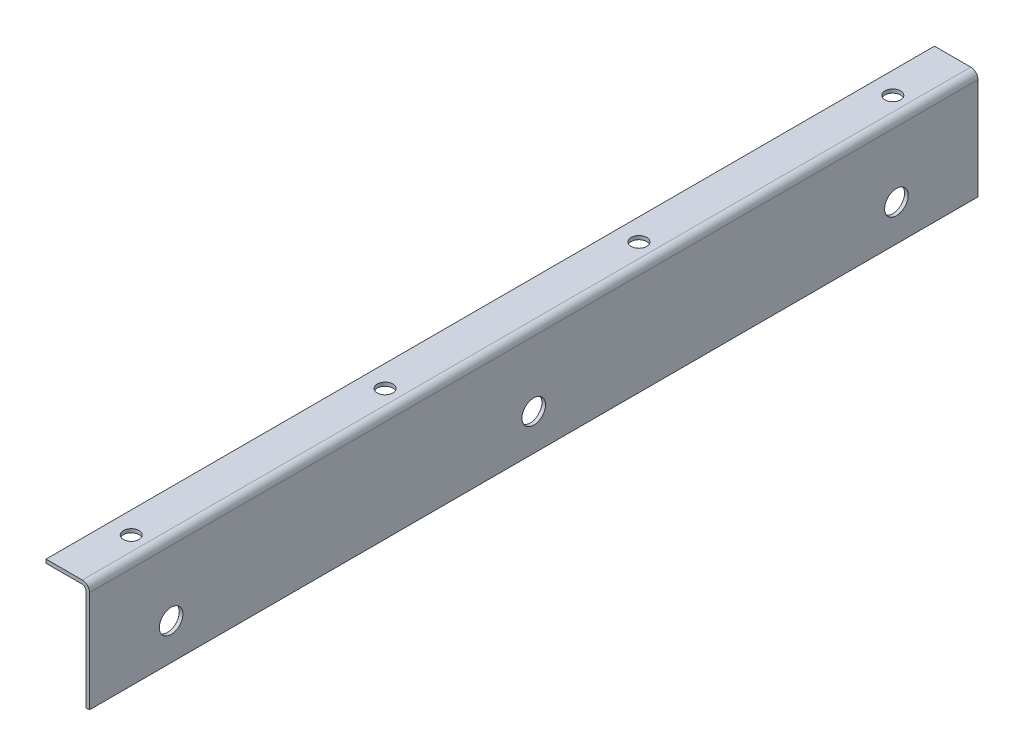
from build123d import *

# Parameters (mm, degrees)
EXTRUDE_1_DEPTH     = 245
SKETCH_2_R          = 2.15
CUT_EXTRUDE_1_DEPTH = 245
SKETCH_3_R          = 3.25
CUT_EXTRUDE_2_DEPTH = 245


with BuildPart() as part:
    # Эскиз1 → Вытянуть1 (new body)
    with BuildSketch(Plane.XY):
        with BuildLine():
            Line((-1, -2), (-1, -30))
            Line((-1, -30), (0, -30))
            Line((0, -30), (0, -2))
            ThreePointArc((0, -2), (-0.585786438, -0.585786438), (-2, 0))
            Line((-2, 0), (-12, 0))
            Line((-12, 0), (-12, -1))
            Line((-12, -1), (-2, -1))
            ThreePointArc((-2, -1), (-1.292893219, -1.292893219), (-1, -2))
        make_face()
    extrude(amount=EXTRUDE_1_DEPTH)

    # Эскиз2 → Вырез-Вытянуть1 (cut)
    with BuildSketch(Plane(origin=(0, 0, 0), x_dir=(1, 0, 0), z_dir=(0, 1, 0))):
        with Locations(Location((-6, -17.5, 0), (0, 0, 180))):
            Circle(SKETCH_2_R)
        with Locations(Location((-6, -87.5, 0), (0, 0, 180))):
            Circle(SKETCH_2_R)
        with Locations(Location((-6, -157.5, 0), (0, 0, 180))):
            Circle(SKETCH_2_R)
        with Locations(Location((-6, -227.5, 0), (0, 0, 180))):
            Circle(SKETCH_2_R)
    extrude(amount=-CUT_EXTRUDE_1_DEPTH, mode=Mode.SUBTRACT)

    # Эскиз3 → Вырез-Вытянуть2 (cut)
    with BuildSketch(Plane(origin=(0, 0, 0), x_dir=(0, 0, -1), z_dir=(1, 0, 0))):
        with Locations(Location((-122.5, -20, 0), (0, 0, 90))):
            Circle(SKETCH_3_R)
        with Locations(Location((-22.5, -20, 0), (0, 0, 90))):
            Circle(SKETCH_3_R)
        with Locations((-222.5, -20)):
            Circle(SKETCH_3_R)
    extrude(amount=-CUT_EXTRUDE_2_DEPTH, mode=Mode.SUBTRACT)


solid = part.part
